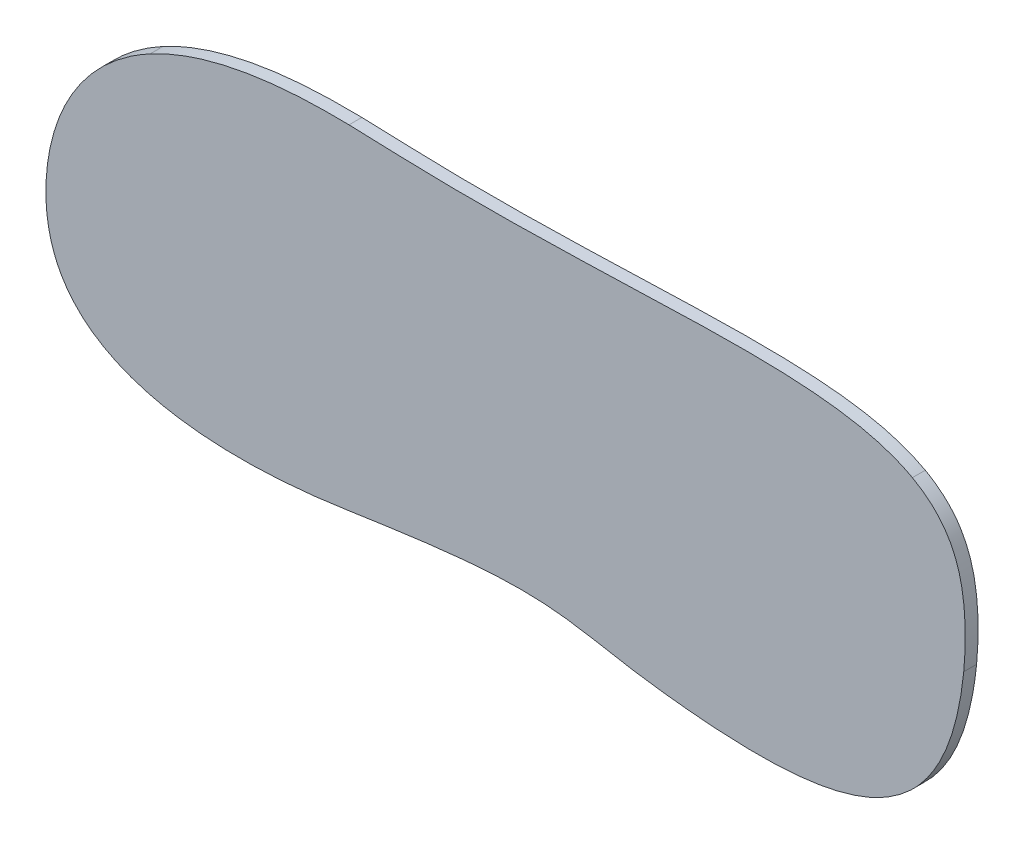
from build123d import *

# Parameters (mm, degrees)
BOSS_EXTRUDE1_DEPTH = 2


with BuildPart() as part:
    # Sketch1 → Boss-Extrude1 (new body)
    with BuildSketch(Plane.XY):
        with BuildLine():
            add(Edge.make_bspline(
                [(42.254555433, 0.147491636), (42.357527928, 1.189654109), (42.429661522, 2.232689939), (42.50709154, 4.320654428), (42.51255676, 5.365578306), (42.442786882, 7.457711495), (42.367698351, 8.502293443), (42.114292364, 10.564097845), (41.937085255, 11.58438322), (41.430828506, 13.593034081), (41.099175069, 14.581958917), (40.21807674, 16.509553986), (39.685127794, 17.41062061), (38.736453804, 18.660893203), (38.395384144, 19.060783278), (37.662639186, 19.826206877), (37.275770546, 20.18645437), (36.067960398, 21.197855015), (35.196182138, 21.783754372), (34.270812785, 22.298516315)],
                knots=[0, 0, 0, 0, 0.125, 0.125, 0.25, 0.25, 0.375, 0.375, 0.5, 0.5, 0.625, 0.625, 0.75, 0.75, 0.8125, 0.8125, 0.875, 0.875, 1, 1, 1, 1], degree=3))
            add(Edge.make_bspline(
                [(34.270812785, 22.298516315), (33.45091286, 22.754608011), (32.610347852, 23.1435514), (30.899496832, 23.82486392), (30.029089503, 24.116838846), (27.384412134, 24.88405503), (25.576662512, 25.251639126), (21.909570483, 25.814621969), (20.0753308, 26.005227958), (16.406035598, 26.27954802), (14.570970807, 26.362047301), (10.900331001, 26.4601954), (9.06475148, 26.475254024), (5.393277351, 26.464088036), (3.557380256, 26.437537651), (-1.950579769, 26.322675756), (-5.622906828, 26.199757695), (-12.967559425, 25.954120765), (-16.639869453, 25.830255047), (-23.984199611, 25.63861252), (-27.656235207, 25.570366288), (-34.999851743, 25.5306977), (-38.671433692, 25.559060601), (-43.260530776, 25.675514463), (-44.178331243, 25.702840848), (-46.013892062, 25.766036726), (-46.93165263, 25.801860059), (-49.684941646, 25.90777277), (-51.520481355, 25.975464081), (-53.356182015, 26.008878987)],
                knots=[0, 0, 0, 0, 0.03125, 0.03125, 0.0625, 0.0625, 0.125, 0.125, 0.1875, 0.1875, 0.25, 0.25, 0.3125, 0.3125, 0.375, 0.375, 0.5, 0.5, 0.625, 0.625, 0.75, 0.75, 0.875, 0.875, 0.90625, 0.90625, 0.9375, 0.9375, 1, 1, 1, 1], degree=3))
            add(Edge.make_bspline(
                [(-53.356182015, 26.008878987), (-56.017284847, 26.057318531), (-58.67724197, 26.03660848), (-63.99279506, 25.731969361), (-66.637523426, 25.454977459), (-70.576071928, 24.795289884), (-71.878758496, 24.535193979), (-74.451881384, 23.926274503), (-75.723701138, 23.577253526), (-79.488833317, 22.378061694), (-81.932756658, 21.378597323), (-84.285903477, 20.104733327)],
                knots=[0, 0, 0, 0, 0.25, 0.25, 0.5, 0.5, 0.625, 0.625, 0.75, 0.75, 1, 1, 1, 1], degree=3))
            add(Edge.make_bspline(
                [(-84.285903477, 20.104733327), (-86.243668655, 19.04490716), (-88.089328033, 17.819942875), (-90.230085424, 16.043743516), (-90.648741369, 15.677034404), (-91.461012999, 14.925425227), (-91.855498364, 14.539810344), (-93.003741638, 13.353314641), (-93.722322166, 12.522812605), (-95.063439745, 10.780934854), (-95.685998708, 9.869577587), (-96.545075204, 8.439588178), (-96.818228201, 7.953420385), (-97.332937593, 6.972523784), (-97.575368205, 6.476373625), (-98.714832207, 3.96785142), (-99.396532307, 1.873209654), (-99.85314935, -0.307426804)],
                knots=[0, 0, 0, 0, 0.25, 0.25, 0.3125, 0.3125, 0.375, 0.375, 0.5, 0.5, 0.625, 0.625, 0.6875, 0.6875, 0.75, 0.75, 1, 1, 1, 1], degree=3))
            add(Edge.make_bspline(
                [(-99.85314935, -0.307426804), (-100.14051455, -1.679778191), (-100.331986994, -3.055968901), (-100.528564311, -5.815812043), (-100.53708908, -7.199327552), (-100.402537913, -8.934535692), (-100.368287375, -9.281871208), (-100.283421356, -9.977197456), (-100.232649746, -10.326034758), (-100.055206061, -11.363139778), (-99.903283497, -12.04419862), (-99.525579806, -13.383595412), (-99.29967189, -14.04189436), (-98.764969227, -15.332994025), (-98.453321931, -15.970026404), (-97.409175926, -17.7896486), (-96.565970976, -18.891117915), (-95.090785963, -20.383706122), (-94.562489524, -20.855363909), (-93.469619231, -21.72400101), (-92.901743324, -22.124781656), (-91.729150022, -22.868715032), (-91.124315887, -23.211685156), (-89.881965149, -23.846503081), (-89.242471007, -24.139085478), (-87.298729798, -24.941242749), (-85.968550779, -25.377452728), (-84.61265543, -25.739877353)],
                knots=[0, 0, 0, 0, 0.125, 0.125, 0.25, 0.25, 0.28125, 0.28125, 0.3125, 0.3125, 0.375, 0.375, 0.4375, 0.4375, 0.5, 0.5, 0.625, 0.625, 0.6875, 0.6875, 0.75, 0.75, 0.8125, 0.8125, 0.875, 0.875, 1, 1, 1, 1], degree=3))
            add(Edge.make_bspline(
                [(-84.61265543, -25.739877353), (-83.350370047, -26.077280463), (-82.076564561, -26.347582858), (-79.51123721, -26.78499571), (-78.219675123, -26.951871889), (-74.323455793, -27.327077564), (-71.717759973, -27.410050866), (-66.500869096, -27.345401316), (-63.900066532, -27.196684894), (-60.012726683, -26.842340554), (-58.718943158, -26.702054489), (-56.134993667, -26.381307565), (-54.845196518, -26.196750811), (-53.555839789, -26.007302967)],
                knots=[0, 0, 0, 0, 0.125, 0.125, 0.25, 0.25, 0.5, 0.5, 0.75, 0.75, 0.875, 0.875, 1, 1, 1, 1], degree=3))
            add(Edge.make_bspline(
                [(-53.555839789, -26.007302967), (-49.478043597, -25.408143959), (-45.400438467, -24.807613645), (-39.264753562, -24.045176184), (-37.217430777, -23.814464467), (-33.115426536, -23.440382029), (-31.060733362, -23.296600048), (-26.938073638, -23.164600448), (-24.8802971, -23.179379937), (-21.807089534, -23.37778787), (-20.784687654, -23.473227264), (-18.743651668, -23.719292696), (-17.725028524, -23.870079287), (-15.690116591, -24.20584378), (-14.675159008, -24.39010391), (-12.645691165, -24.760512872), (-11.631034408, -24.946195442), (-9.598222133, -25.295883521), (-8.580063191, -25.459867825), (-6.538833416, -25.757404146), (-5.515772475, -25.891017449), (-4.490374877, -26.010153675)],
                knots=[0, 0, 0, 0, 0.25, 0.25, 0.375, 0.375, 0.5, 0.5, 0.625, 0.625, 0.6875, 0.6875, 0.75, 0.75, 0.8125, 0.8125, 0.875, 0.875, 0.9375, 0.9375, 1, 1, 1, 1], degree=3))
            add(Edge.make_bspline(
                [(-4.490374877, -26.010153675), (-2.827423356, -26.220643358), (-1.160922379, -26.389546162), (2.176076989, -26.680516402), (3.846836603, -26.799523252), (7.194684015, -26.963393321), (8.869254594, -27.008294551), (12.215566288, -26.995364126), (13.887893581, -26.937900459), (16.394628289, -26.743606591), (17.230196709, -26.660641197), (18.889496465, -26.452818507), (19.714480605, -26.327914327), (22.173015814, -25.879334814), (23.790417112, -25.482995845), (26.170541832, -24.681619244), (26.960177466, -24.377817584), (28.492185655, -23.700027284), (29.23620247, -23.325866653), (31.396242612, -22.087887163), (32.740155177, -21.108409582), (33.971856948, -19.948956682)],
                knots=[0, 0, 0, 0, 0.125, 0.125, 0.25, 0.25, 0.375, 0.375, 0.5, 0.5, 0.5625, 0.5625, 0.625, 0.625, 0.75, 0.75, 0.8125, 0.8125, 0.875, 0.875, 1, 1, 1, 1], degree=3))
            add(Edge.make_bspline(
                [(33.971856948, -19.948956682), (34.651256548, -19.309409144), (35.281352636, -18.629385126), (36.449105521, -17.193447629), (36.987573495, -16.436290255), (38.469087983, -14.066821684), (39.254304834, -12.401797499), (40.215299226, -9.812822233), (40.499325301, -8.934520261), (41.003776196, -7.151095255), (41.223524471, -6.247959026), (41.797540589, -3.530359899), (42.07205568, -1.699549118), (42.254555433, 0.147491636)],
                knots=[0, 0, 0, 0, 0.125, 0.125, 0.25, 0.25, 0.5, 0.5, 0.625, 0.625, 0.75, 0.75, 1, 1, 1, 1], degree=3))
        make_face()
    extrude(amount=BOSS_EXTRUDE1_DEPTH)


solid = part.part
